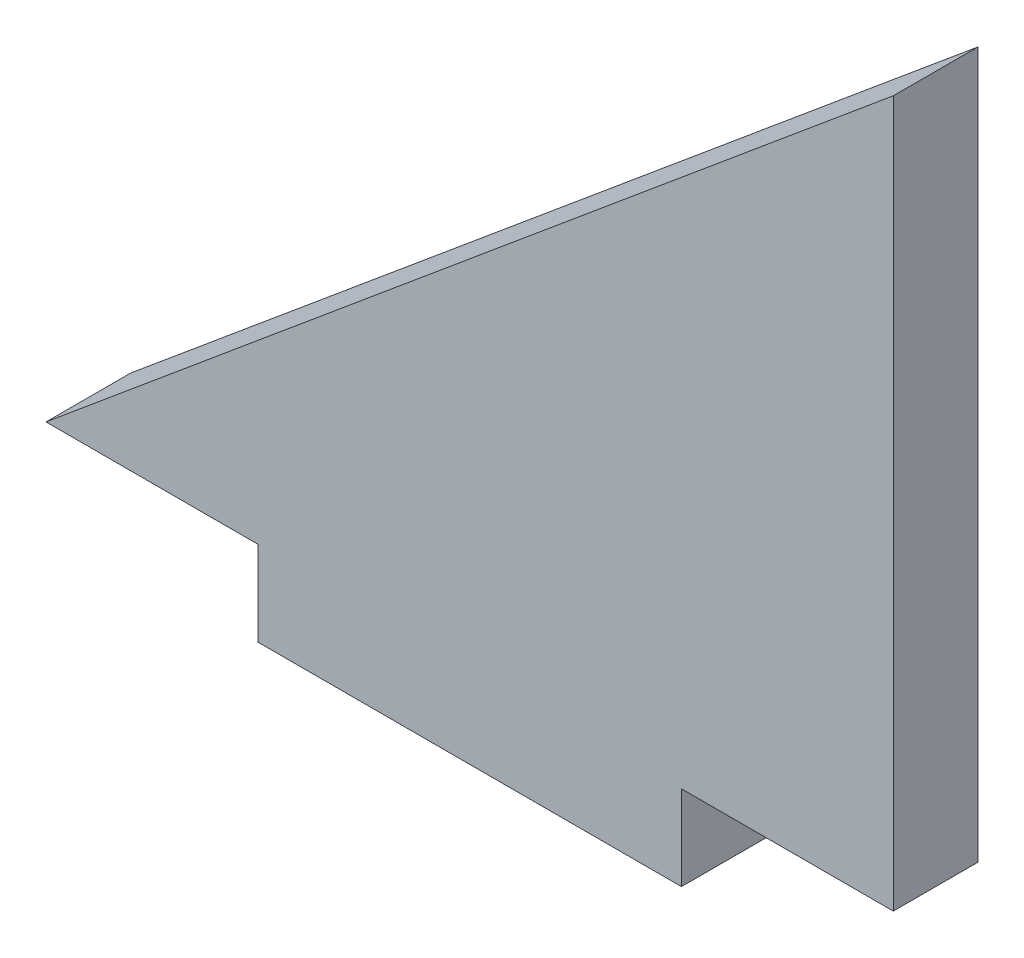
from build123d import *

# Parameters (mm, degrees)
BOSS_EXTRUDE1_DEPTH = 1.5


with BuildPart() as part:
    # Sketch2 → Boss-Extrude1 (new, symmetric)
    with BuildSketch(Plane.XY):
        Polygon((0, 0), (-7.5, 0), (-7.5, -3), (-22.5, -3), (-22.5, 0), (-30, 0), (0, 25), align=None)
    extrude(amount=BOSS_EXTRUDE1_DEPTH, both=True)


solid = part.part
